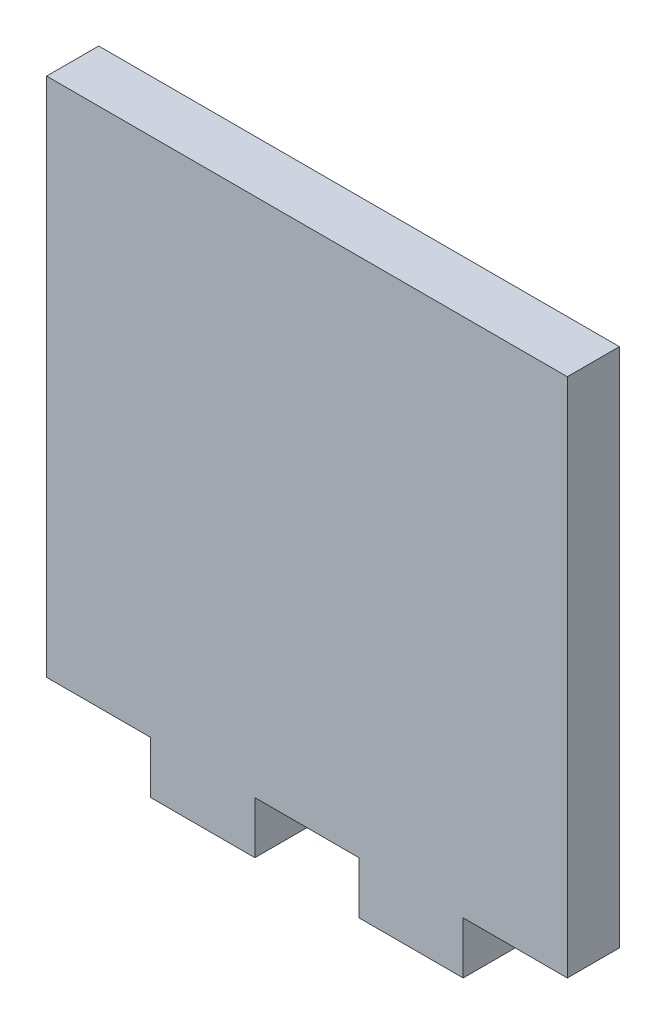
from build123d import *

# Parameters (mm, degrees)
BOSS_EXTRU_1_DEPTH = 5


with BuildPart() as part:
    # Esquisse1 → Boss.-Extru.1 (new body)
    with BuildSketch(Plane.XY):
        Polygon((-7.57444963, 0), (2.42555037, 0), (2.42555037, -5), (12.42555037, -5), (12.42555037, 0), (22.42555037, 0), (22.42555037, -5), (32.42555037, -5), (32.42555037, 0), (42.42555037, 0), (42.42555037, 50), (-7.57444963, 50), align=None)
    extrude(amount=BOSS_EXTRU_1_DEPTH)


solid = part.part
